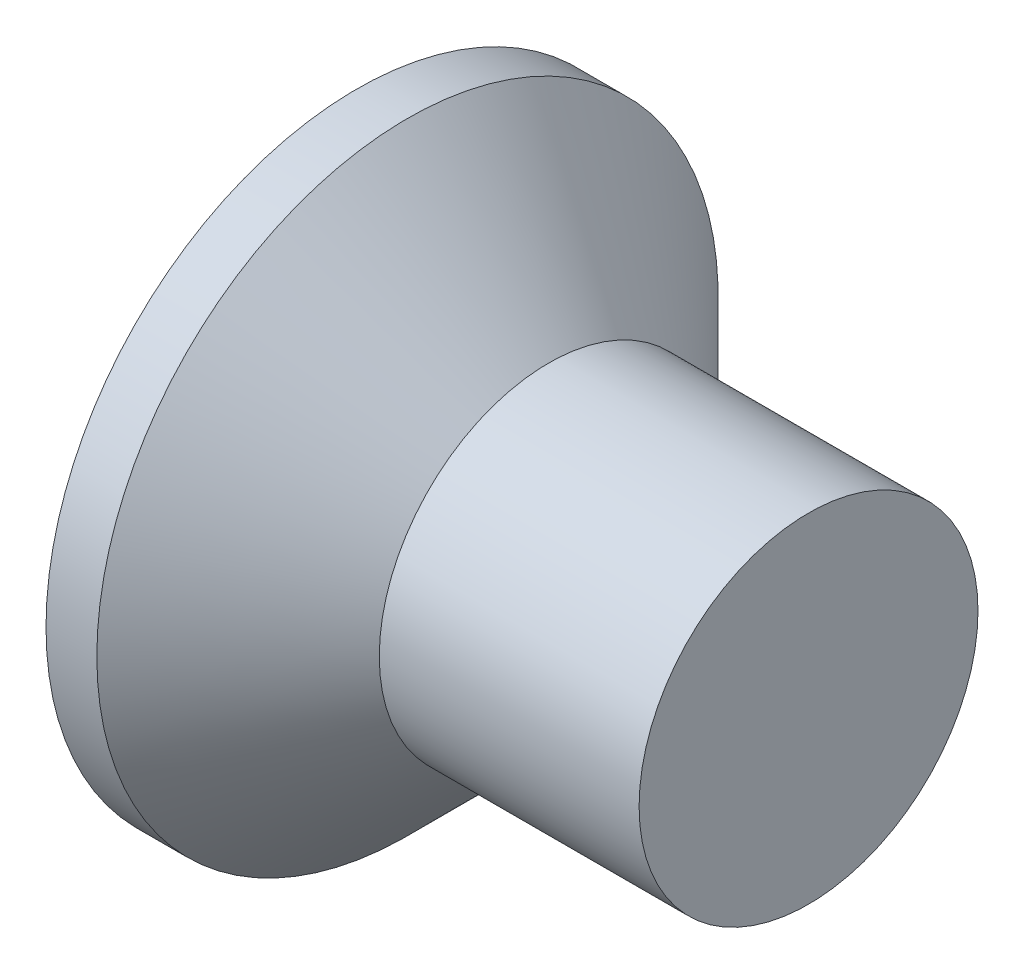
from build123d import *

# Parameters (mm, degrees)
CIRPATTERN1_COUNT = 2
CIRPATTERN1_ANGLE = 90


with BuildPart() as part:
    # BodySke → Base-Revolve (revolve)
    with BuildSketch(Plane.XY, mode=Mode.PRIVATE) as base_revolve_sk:
        Polygon((0, 0), (0, 2.75), (0.45, 2.75), (1.7, 1.5), (4, 1.5), (4, 0), align=None)
    revolve(base_revolve_sk.sketch.rotate(Axis((-6.35, 0, 0), (1, 0, 0)), 90), axis=Axis((-6.35, 0, 0), (1, 0, 0)))

    # Sketch3 → Cross section 0
    with BuildSketch(Plane.ZY):
        with BuildLine():
            Line((-0.395, 1.55), (0.395, 1.55))
            Line((0.395, 1.55), (0.395, -1.55))
            Line((0.395, -1.55), (-0.395, -1.55))
            Line((-0.395, -1.55), (-0.395, 1.55))
        make_face()
    # Sketch4 → Cross section 1
    with BuildSketch(Plane.ZY.offset(-2.08)):
        with BuildLine():
            Line((-0.1975, 0.1975), (0.1975, 0.1975))
            Line((0.1975, 0.1975), (0.1975, -0.1975))
            Line((0.1975, -0.1975), (-0.1975, -0.1975))
            Line((-0.1975, -0.1975), (-0.1975, 0.1975))
        make_face()
    cross = loft(mode=Mode.SUBTRACT)

    # CirPattern1: Cross ×2 about axis
    cirpattern1_axis = Axis((0, 0, 0), (1, 0, 0))
    for i in range(1, CIRPATTERN1_COUNT):
        add(cross.rotate(cirpattern1_axis, i * CIRPATTERN1_ANGLE / (CIRPATTERN1_COUNT - 1)), mode=Mode.SUBTRACT)


solid = part.part
